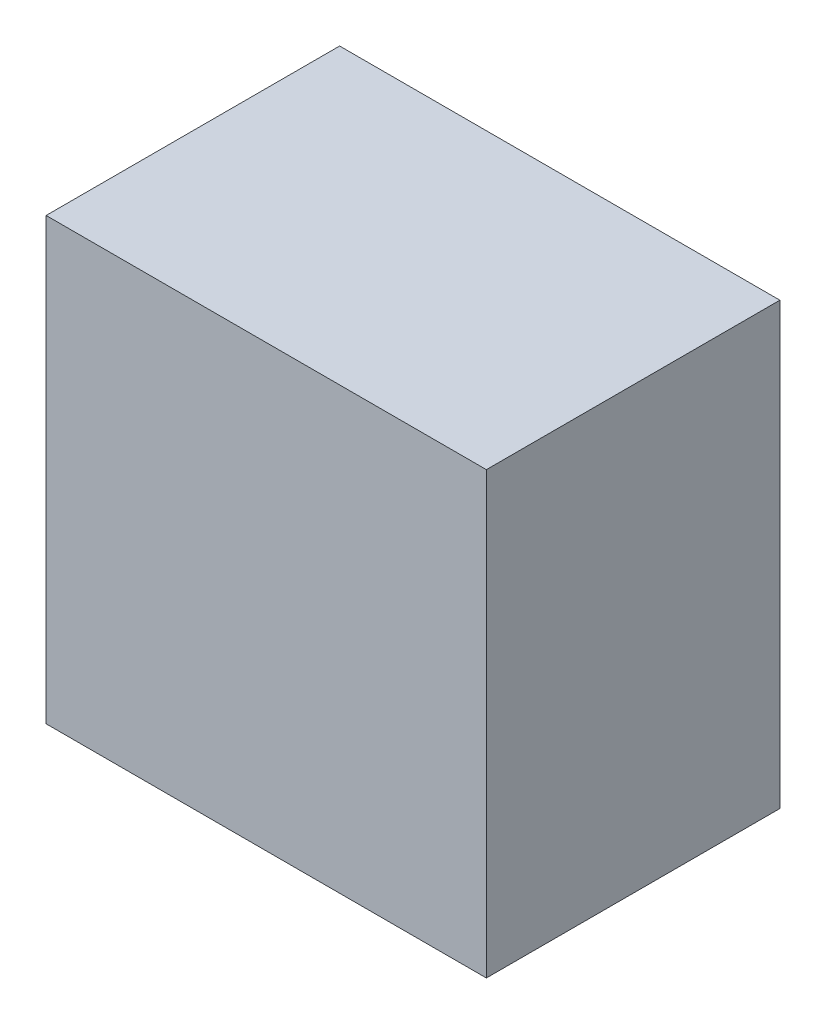
from build123d import *

# Parameters (mm, degrees)
SKETCH1_W           = 300
SKETCH1_H           = 300
BOSS_EXTRUDE1_DEPTH = 200


with BuildPart() as part:
    # Sketch1 → Boss-Extrude1 (new body)
    with BuildSketch(Plane.XY):
        with Locations((150, -150)):
            Rectangle(SKETCH1_W, SKETCH1_H)
    extrude(amount=BOSS_EXTRUDE1_DEPTH)


solid = part.part
